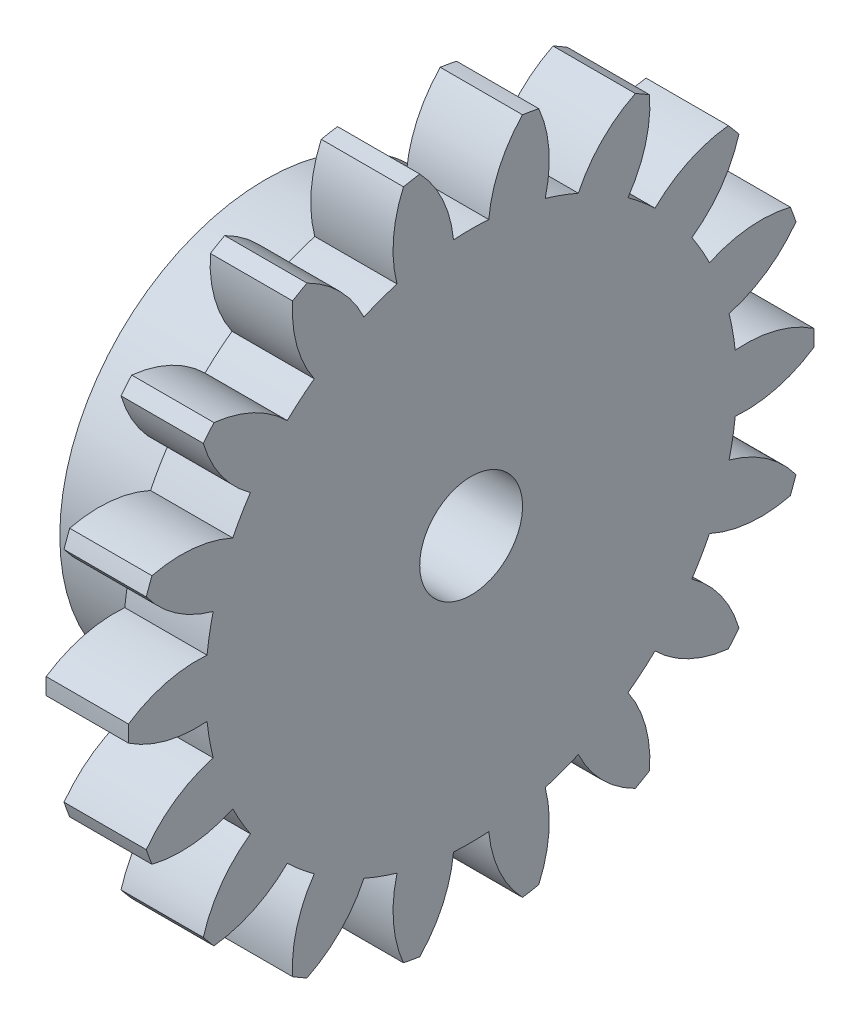
from build123d import *

# Parameters (mm, degrees)
BASPROSKE_W      = 5.08
BASPROSKE_H      = 21.166666667
TOOTHCUT_DEPTH   = 31.36217969
TEETHCUTS_COUNT  = 18
TEETHCUTS_ANGLE  = 340
HUBNEAONESKE_R   = 12.7
HUBNEARONE_DEPTH = 7.6200508
BORSKE_R         = 3.175
BORE_DEPTH       = 12.7000508


with BuildPart() as part:
    # BasProSke → Base-Revolve (revolve)
    with BuildSketch(Plane(origin=(0, 0, 0), x_dir=(1, 0, 0), z_dir=(0, 1, 0)), mode=Mode.PRIVATE) as base_revolve_sk:
        with Locations((2.54, 10.583333334)):
            Rectangle(BASPROSKE_W, BASPROSKE_H)
    revolve(base_revolve_sk.sketch.rotate(Axis((-10, 0, 0), (1, 0, 0)), 180), axis=Axis((-10, 0, 0), (1, 0, 0)))

    # TooCutSke → ToothCut (cut, through all)
    with BuildSketch(Plane(origin=(0, 0, 0), x_dir=(0, 0, -1), z_dir=(1, 0, 0))):
        with BuildLine():
            ThreePointArc((1.088343012, 16.366750702), (0, 16.402896667), (-1.088343012, 16.366750702))
            ThreePointArc((-1.088343012, 16.366750702), (-1.750205221, 18.83761226), (-3.192455936, 20.950224693))
            ThreePointArc((-3.192455936, 20.950224693), (0, 21.192066667), (3.192455936, 20.950224693))
            ThreePointArc((3.192455936, 20.950224693), (1.750205221, 18.83761226), (1.088343012, 16.366750702))
        make_face()
    toothcut = extrude(amount=TOOTHCUT_DEPTH, mode=Mode.SUBTRACT)

    # TeethCuts: ToothCut ×18 about axis
    teethcuts_axis = Axis((-10, 0, 0), (1, 0, 0))
    for i in range(1, TEETHCUTS_COUNT):
        add(toothcut.rotate(teethcuts_axis, i * TEETHCUTS_ANGLE / (TEETHCUTS_COUNT - 1)), mode=Mode.SUBTRACT)

    # HubNeaOneSke → HubNearOne (add)
    with BuildSketch(Plane.ZY):
        with Locations(Location((0, 0, 0), (0, 0, 180))):
            Circle(HUBNEAONESKE_R)
    extrude(amount=HUBNEARONE_DEPTH)

    # BorSke → Bore (cut, symmetric)
    with BuildSketch(Plane(origin=(0, 0, 0), x_dir=(0, 0, -1), z_dir=(1, 0, 0))):
        with Locations(Location((0, 0, 0), (0, 0, 180))):
            Circle(BORSKE_R)
    extrude(amount=BORE_DEPTH, both=True, mode=Mode.SUBTRACT)


solid = part.part
